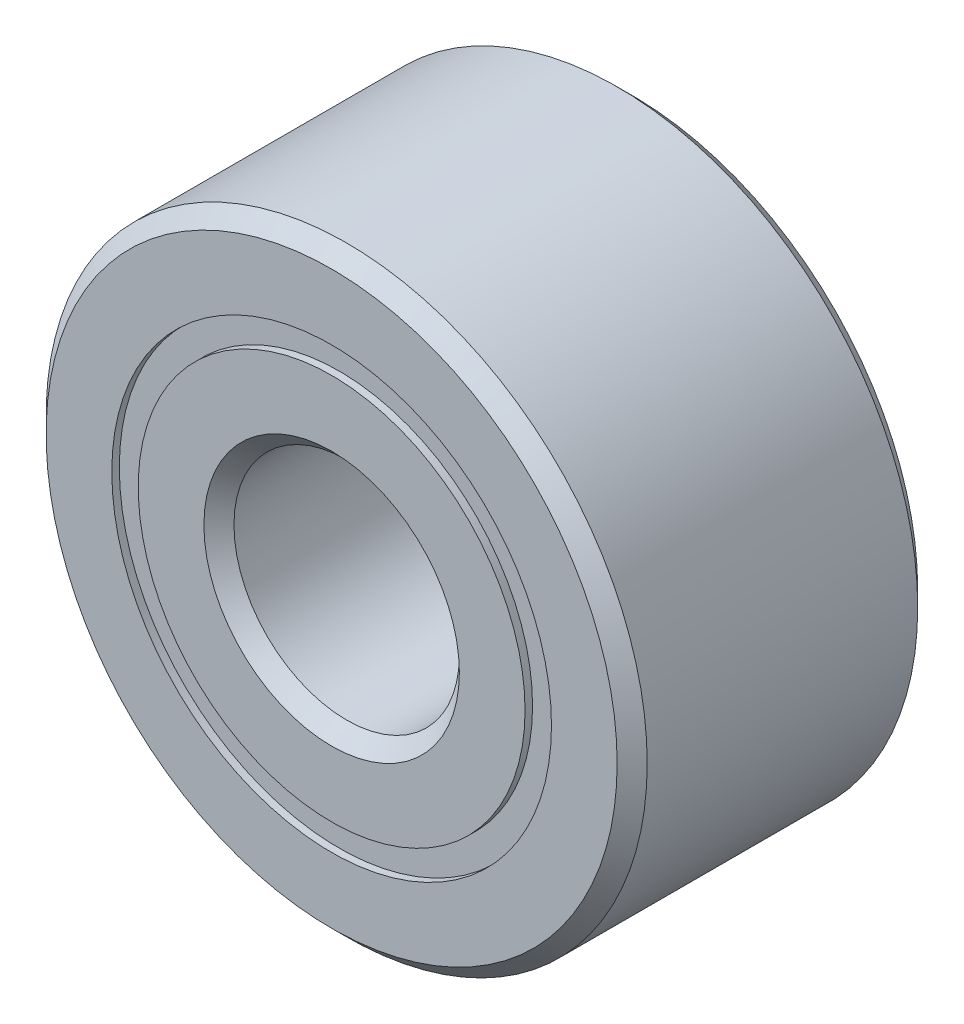
from build123d import *

# Parameters (mm, degrees)
CIRPATTERN1_COUNT = 12
SKETCH5_W         = 0.99388875
SKETCH5_H         = 0.351648352


with BuildPart() as part:
    # Sketch1 → Revolve1 (revolve)
    with BuildSketch(Plane(origin=(0, 0, 0), x_dir=(0, 0, -1), z_dir=(1, 0, 0))):
        with BuildLine():
            Line((1.8, 4), (-1.8, 4))
            Line((-1.8, 4), (-2, 3.8))
            Line((-2, 3.8), (-2, 2.925824176))
            Line((-2, 2.925824176), (-0.888888889, 2.925824176))
            ThreePointArc((-0.888888889, 2.925824176), (0, 3.65611125), (0.888888889, 2.925824176))
            Line((0.888888889, 2.925824176), (2, 2.925824176))
            Line((2, 2.925824176), (2, 3.8))
            Line((2, 3.8), (1.8, 4))
        make_face()
    revolve(axis=Axis((0, 0, 2), (0, 0, -1)))


with BuildPart() as body_2:
    # Sketch3 → Revolve3 (revolve)
    with BuildSketch(Plane(origin=(0, 0, 0), x_dir=(0, 0, -1), z_dir=(1, 0, 0))):
        with BuildLine():
            Line((-2, 2.574175824), (-0.888888889, 2.574175824))
            ThreePointArc((-0.888888889, 2.574175824), (0, 1.84388875), (0.888888889, 2.574175824))
            Line((0.888888889, 2.574175824), (2, 2.574175824))
            Line((2, 2.574175824), (2, 1.7))
            Line((2, 1.7), (1.8, 1.5))
            Line((1.8, 1.5), (-1.8, 1.5))
            Line((-1.8, 1.5), (-2, 1.7))
            Line((-2, 1.7), (-2, 2.574175824))
        make_face()
    revolve(axis=Axis((0, 0, 2), (0, 0, -1)))


with BuildPart() as body_3:
    # Sketch4 → Revolve4 (revolve)
    with BuildSketch(Plane(origin=(0, 0, 0), x_dir=(0, 0, -1), z_dir=(1, 0, 0))):
        with BuildLine():
            Line((-0.90611125, 2.75), (0.90611125, 2.75))
            ThreePointArc((0.90611125, 2.75), (0, 3.65611125), (-0.90611125, 2.75))
        make_face()
    revolve(axis=Axis((0, 2.75, 0.90611125), (0, 0, -1)))


with BuildPart() as cirpattern1_1:
    # CirPattern1: pattern copy
    add(body_3.part.rotate(Axis((0, 0, -2), (0, 0, 1)), 1 * 360 / CIRPATTERN1_COUNT))


with BuildPart() as cirpattern1_2:
    # CirPattern1: pattern copy
    add(body_3.part.rotate(Axis((0, 0, -2), (0, 0, 1)), 2 * 360 / CIRPATTERN1_COUNT))


with BuildPart() as cirpattern1_3:
    # CirPattern1: pattern copy
    add(body_3.part.rotate(Axis((0, 0, -2), (0, 0, 1)), 3 * 360 / CIRPATTERN1_COUNT))


with BuildPart() as cirpattern1_4:
    # CirPattern1: pattern copy
    add(body_3.part.rotate(Axis((0, 0, -2), (0, 0, 1)), 4 * 360 / CIRPATTERN1_COUNT))


with BuildPart() as cirpattern1_5:
    # CirPattern1: pattern copy
    add(body_3.part.rotate(Axis((0, 0, -2), (0, 0, 1)), 5 * 360 / CIRPATTERN1_COUNT))


with BuildPart() as cirpattern1_6:
    # CirPattern1: pattern copy
    add(body_3.part.rotate(Axis((0, 0, -2), (0, 0, 1)), 6 * 360 / CIRPATTERN1_COUNT))


with BuildPart() as cirpattern1_7:
    # CirPattern1: pattern copy
    add(body_3.part.rotate(Axis((0, 0, -2), (0, 0, 1)), 7 * 360 / CIRPATTERN1_COUNT))


with BuildPart() as cirpattern1_8:
    # CirPattern1: pattern copy
    add(body_3.part.rotate(Axis((0, 0, -2), (0, 0, 1)), 8 * 360 / CIRPATTERN1_COUNT))


with BuildPart() as cirpattern1_9:
    # CirPattern1: pattern copy
    add(body_3.part.rotate(Axis((0, 0, -2), (0, 0, 1)), 9 * 360 / CIRPATTERN1_COUNT))


with BuildPart() as cirpattern1_10:
    # CirPattern1: pattern copy
    add(body_3.part.rotate(Axis((0, 0, -2), (0, 0, 1)), 10 * 360 / CIRPATTERN1_COUNT))


with BuildPart() as cirpattern1_11:
    # CirPattern1: pattern copy
    add(body_3.part.rotate(Axis((0, 0, -2), (0, 0, 1)), 11 * 360 / CIRPATTERN1_COUNT))


with BuildPart() as body_15:
    # Sketch5 → Revolve5 (revolve)
    with BuildSketch(Plane(origin=(0, 0, 0), x_dir=(0, 0, -1), z_dir=(1, 0, 0))):
        with Locations((-1.403055625, 2.75)):
            Rectangle(SKETCH5_W, SKETCH5_H)
        with Locations((1.403055625, 2.75)):
            Rectangle(SKETCH5_W, SKETCH5_H)
    revolve(axis=Axis((0, 0, 2), (0, 0, -1)))


solid = Compound([part.part, body_2.part, body_3.part, cirpattern1_1.part, cirpattern1_2.part, cirpattern1_3.part, cirpattern1_4.part, cirpattern1_5.part, cirpattern1_6.part, cirpattern1_7.part, cirpattern1_8.part, cirpattern1_9.part, cirpattern1_10.part, cirpattern1_11.part, body_15.part])
